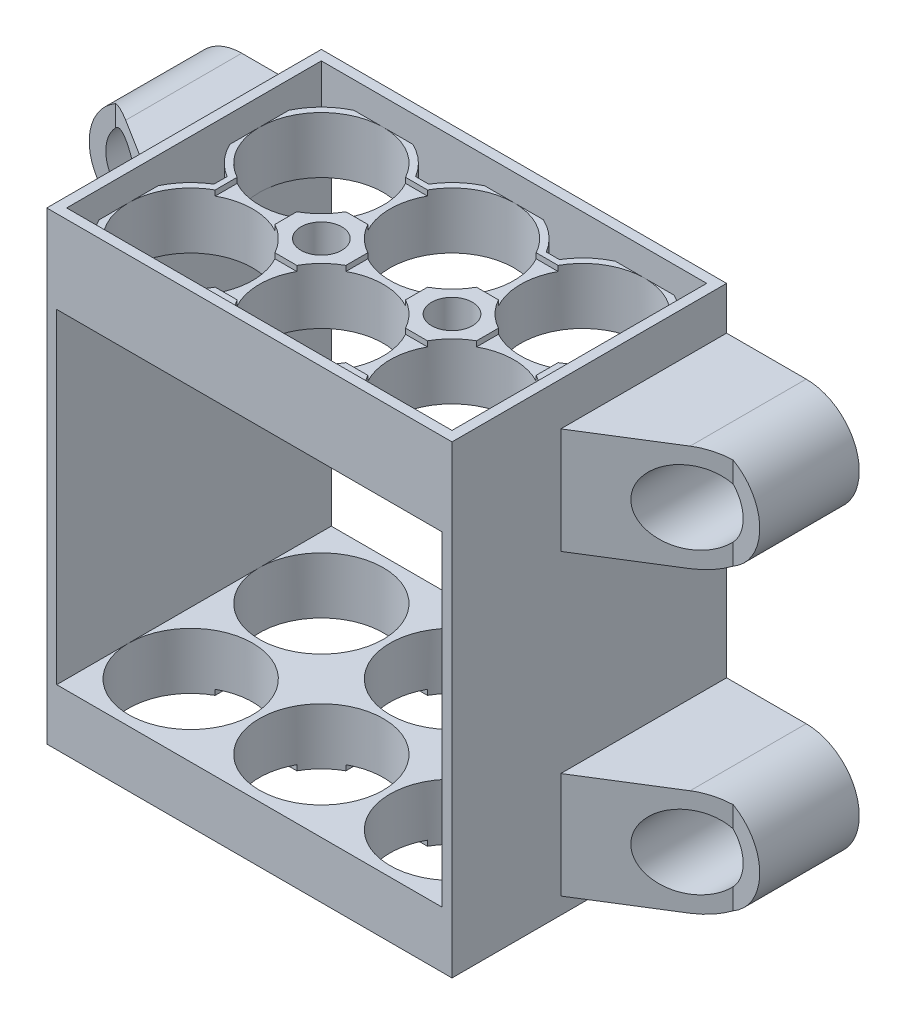
from build123d import *

# Parameters (mm, degrees)
SKETCH3_W                       = 61.1
SKETCH3_H                       = 41.4
SKETCH3_R                       = 9.35
BOSS_EXTRUDE1_DEPTH             = 66
SKETCH4_R                       = 3.080003589
CUT_EXTRUDE1_DEPTH              = 76.616086252
BOSS_EXTRUDE2_REACH             = 77.616
SKETCH5_W                       = 61.1
SKETCH5_H                       = 1
BOSS_EXTRUDE2_DIRECTION_2_REACH = 77.616
CUT_EXTRUDE3_DEPTH              = 76.616086252
CUT_EXTRUDE3_DEPTH_BACK         = 76.616086252
SKETCH5_3_W                     = 58.1
SKETCH5_3_H                     = 49
SKETCH7_R                       = 9.35
CUT_EXTRUDE4_DEPTH              = 76.616086252
BOSS_EXTRUDE3_START             = -20.7
SKETCH8_R                       = 8
SKETCH8_R_2                     = 5.5
BOSS_EXTRUDE3_DEPTH             = 41.4
CUT_EXTRUDE6_DEPTH              = 86.672588965
CUT_EXTRUDE6_DEPTH_BACK         = 86.672588965
SKETCH10_R                      = 8
SKETCH10_R_2                    = 2.25
BOSS_EXTRUDE4_DEPTH             = 5
SKETCH11_W                      = 61.1
SKETCH11_H                      = 41.4
SKETCH11_W_2                    = 58.1
SKETCH11_H_2                    = 38.4
BOSS_EXTRUDE5_DEPTH             = 4
CUT_EXTRUDE7_START              = -0.8
CUT_EXTRUDE7_DEPTH              = 0.8
CUT_EXTRUDE8_START              = -66
CUT_EXTRUDE8_DEPTH              = 0.8


with BuildPart() as part:
    # Sketch3 → Boss-Extrude1 (new body)
    with BuildSketch(Plane(origin=(0, 0, 0), x_dir=(1, 0, 0), z_dir=(0, 1, 0))):
        Rectangle(SKETCH3_W, SKETCH3_H)
        with Locations(Location((-19.7, 9.85, 0), (0, 0, 270))):
            Circle(SKETCH3_R, mode=Mode.SUBTRACT)
        with Locations(Location((0, 9.85, 0), (0, 0, 270))):
            Circle(SKETCH3_R, mode=Mode.SUBTRACT)
        with Locations(Location((19.7, 9.85, 0), (0, 0, 270))):
            Circle(SKETCH3_R, mode=Mode.SUBTRACT)
        with Locations(Location((-19.7, -9.85, 0), (0, 0, 270))):
            Circle(SKETCH3_R, mode=Mode.SUBTRACT)
        with Locations(Location((0, -9.85, 0), (0, 0, 270))):
            Circle(SKETCH3_R, mode=Mode.SUBTRACT)
        with Locations(Location((19.7, -9.85, 0), (0, 0, 270))):
            Circle(SKETCH3_R, mode=Mode.SUBTRACT)
    extrude(amount=BOSS_EXTRUDE1_DEPTH)

    # Sketch4 → Cut-Extrude1 (cut, through all)
    with BuildSketch(Plane(origin=(0, 0, 0), x_dir=(1, 0, 0), z_dir=(0, 1, 0))):
        with Locations(Location((-9.85, 0, 0), (0, 0, 270))):
            Circle(SKETCH4_R)
        with Locations(Location((9.85, 0, 0), (0, 0, 270))):
            Circle(SKETCH4_R)
        with BuildLine():
            Line((-4.438468204, 19.2), (-15.261531796, 19.2))
            ThreePointArc((-15.261531796, 19.2), (-12.756480414, 17.525287341), (-10.839977427, 15.2))
            Line((-10.839977427, 15.2), (-8.860022573, 15.2))
            ThreePointArc((-8.860022573, 15.2), (-6.943519586, 17.525287341), (-4.438468204, 19.2))
        make_face()
        with BuildLine():
            Line((15.261531796, 19.2), (4.438468204, 19.2))
            ThreePointArc((4.438468204, 19.2), (6.943519586, 17.525287341), (8.860022573, 15.2))
            Line((8.860022573, 15.2), (10.839977427, 15.2))
            ThreePointArc((10.839977427, 15.2), (12.756480414, 17.525287341), (15.261531796, 19.2))
        make_face()
        with BuildLine():
            Line((29.05, -5.411531796), (29.05, 5.411531796))
            ThreePointArc((29.05, 5.411531796), (27.375287341, 2.906480414), (25.05, 0.989977427))
            Line((25.05, 0.989977427), (25.05, -0.989977427))
            ThreePointArc((25.05, -0.989977427), (27.375287341, -2.906480414), (29.05, -5.411531796))
        make_face()
        with BuildLine():
            Line((29.05, -19.2), (29.05, -14.288468204))
            ThreePointArc((29.05, -14.288468204), (27.018555185, -17.168555185), (24.138468204, -19.2))
            Line((24.138468204, -19.2), (29.05, -19.2))
        make_face()
        with BuildLine():
            Line((29.05, 19.2), (24.138468204, 19.2))
            ThreePointArc((24.138468204, 19.2), (27.018555185, 17.168555185), (29.05, 14.288468204))
            Line((29.05, 14.288468204), (29.05, 19.2))
        make_face()
        with BuildLine():
            ThreePointArc((15.261531796, -19.2), (12.756480414, -17.525287341), (10.839977427, -15.2))
            Line((10.839977427, -15.2), (8.860022573, -15.2))
            ThreePointArc((8.860022573, -15.2), (6.943519586, -17.525287341), (4.438468204, -19.2))
            Line((4.438468204, -19.2), (15.261531796, -19.2))
        make_face()
        with BuildLine():
            ThreePointArc((-4.438468204, -19.2), (-6.943519586, -17.525287341), (-8.860022573, -15.2))
            Line((-8.860022573, -15.2), (-10.839977427, -15.2))
            ThreePointArc((-10.839977427, -15.2), (-12.756480414, -17.525287341), (-15.261531796, -19.2))
            Line((-15.261531796, -19.2), (-4.438468204, -19.2))
        make_face()
        with BuildLine():
            ThreePointArc((-24.138468204, -19.2), (-27.018555185, -17.168555185), (-29.05, -14.288468204))
            Line((-29.05, -14.288468204), (-29.05, -19.2))
            Line((-29.05, -19.2), (-24.138468204, -19.2))
        make_face()
        with BuildLine():
            ThreePointArc((-25.05, 0.989977427), (-27.375287341, 2.906480414), (-29.05, 5.411531796))
            Line((-29.05, 5.411531796), (-29.05, -5.411531796))
            ThreePointArc((-29.05, -5.411531796), (-27.375287341, -2.906480414), (-25.05, -0.989977427))
            Line((-25.05, -0.989977427), (-25.05, 0.989977427))
        make_face()
        with BuildLine():
            ThreePointArc((-29.05, 14.288468204), (-27.018555185, 17.168555185), (-24.138468204, 19.2))
            Line((-24.138468204, 19.2), (-29.05, 19.2))
            Line((-29.05, 19.2), (-29.05, 14.288468204))
        make_face()
    extrude(amount=CUT_EXTRUDE1_DEPTH, mode=Mode.SUBTRACT)

    # Boss-Extrude2: up to this face of the body (flat: up to its plane)
    boss_extrude2_end = Plane(part.part.faces().sort_by_distance((0, 33, 20.7))[0])
    # Sketch5 → Boss-Extrude2 (add, up to the picked face)
    with BuildSketch(Plane.XY, mode=Mode.PRIVATE) as boss_extrude2_sk1:
        with Locations((0, 58)):
            Rectangle(SKETCH5_W, SKETCH5_H)
    boss_extrude2_tool1 = split(extrude(boss_extrude2_sk1.sketch, amount=BOSS_EXTRUDE2_REACH, mode=Mode.PRIVATE), bisect_by=boss_extrude2_end, keep=Keep.BOTH, mode=Mode.PRIVATE)
    # Sketch5 → Boss-Extrude2 (add, up to the picked face)
    with BuildSketch(Plane.XY, mode=Mode.PRIVATE) as boss_extrude2_sk2:
        with Locations((0, 8)):
            Rectangle(SKETCH5_W, SKETCH5_H)
    boss_extrude2_tool2 = split(extrude(boss_extrude2_sk2.sketch, amount=BOSS_EXTRUDE2_REACH, mode=Mode.PRIVATE), bisect_by=boss_extrude2_end, keep=Keep.BOTH, mode=Mode.PRIVATE)
    add(boss_extrude2_tool1.solids().sort_by(Axis((0, 58, 0), (0, 0, 1)))[0])
    add(boss_extrude2_tool2.solids().sort_by(Axis((0, 8, 0), (0, 0, 1)))[0])

    # Boss-Extrude2 direction 2: up to this face of the body (flat: up to its plane)
    boss_extrude2_direction_2_end = Plane(part.part.faces().sort_by_distance((0, 33, -20.7))[0])
    # Sketch5 → Boss-Extrude2 direction 2 (add, up to the picked face)
    with BuildSketch(Plane.XY, mode=Mode.PRIVATE) as boss_extrude2_direction_2_sk1:
        with Locations((0, 58)):
            Rectangle(SKETCH5_W, SKETCH5_H)
    boss_extrude2_direction_2_tool1 = split(extrude(boss_extrude2_direction_2_sk1.sketch, amount=-BOSS_EXTRUDE2_DIRECTION_2_REACH, mode=Mode.PRIVATE), bisect_by=boss_extrude2_direction_2_end, keep=Keep.BOTH, mode=Mode.PRIVATE)
    # Sketch5 → Boss-Extrude2 direction 2 (add, up to the picked face)
    with BuildSketch(Plane.XY, mode=Mode.PRIVATE) as boss_extrude2_direction_2_sk2:
        with Locations((0, 8)):
            Rectangle(SKETCH5_W, SKETCH5_H)
    boss_extrude2_direction_2_tool2 = split(extrude(boss_extrude2_direction_2_sk2.sketch, amount=-BOSS_EXTRUDE2_DIRECTION_2_REACH, mode=Mode.PRIVATE), bisect_by=boss_extrude2_direction_2_end, keep=Keep.BOTH, mode=Mode.PRIVATE)
    add(boss_extrude2_direction_2_tool1.solids().sort_by(Axis((0, 58, 0), (0, 0, -1)))[0])
    add(boss_extrude2_direction_2_tool2.solids().sort_by(Axis((0, 8, 0), (0, 0, -1)))[0])

    # Sketch5<3> → Cut-Extrude3 (cut, two sides: drawn at the far end of the back side and taken through both)
    with BuildSketch(Plane.XY.offset(-CUT_EXTRUDE3_DEPTH_BACK)):
        with Locations((0, 33)):
            Rectangle(SKETCH5_3_W, SKETCH5_3_H)
    extrude(amount=CUT_EXTRUDE3_DEPTH + CUT_EXTRUDE3_DEPTH_BACK, mode=Mode.SUBTRACT)

    # Sketch7 → Cut-Extrude4 (cut, through all)
    with BuildSketch(Plane(origin=(0, 0, 0), x_dir=(1, 0, 0), z_dir=(0, 1, 0))):
        with Locations(Location((-19.7, 9.85, 0), (0, 0, 180))):
            Circle(SKETCH7_R)
        with Locations(Location((0, 9.85, 0), (0, 0, 270))):
            Circle(SKETCH7_R)
        with Locations((19.7, 9.85)):
            Circle(SKETCH7_R)
        with Locations((19.7, -9.85)):
            Circle(SKETCH7_R)
        with Locations(Location((0, -9.85, 0), (0, 0, 270))):
            Circle(SKETCH7_R)
        with Locations(Location((-19.7, -9.85, 0), (0, 0, 180))):
            Circle(SKETCH7_R)
    extrude(amount=CUT_EXTRUDE4_DEPTH, mode=Mode.SUBTRACT)

    # Sketch8 → Boss-Extrude3 (add)
    # profile 1 of 8: a face of its own
    with BuildSketch(Plane.XY.offset(BOSS_EXTRUDE3_START)):
        with BuildLine():
            Line((-30.55, 63.5), (-42.55, 63.5))
            ThreePointArc((-42.55, 63.5), (-36.893145751, 61.156854249), (-34.55, 55.5))
            ThreePointArc((-34.55, 55.5), (-36.893145751, 49.843145751), (-42.55, 47.5))
            Line((-42.55, 47.5), (-30.55, 47.5))
            Line((-30.55, 47.5), (-30.55, 63.5))
        make_face()
    # profile 2 of 8: a face of its own
    with BuildSketch(Plane.XY.offset(BOSS_EXTRUDE3_START)):
        with Locations((-42.55, 55.5)):
            Circle(SKETCH8_R)
        with Locations(Location((-42.55, 55.5, 0), (0, 0, 180))):
            Circle(SKETCH8_R_2, mode=Mode.SUBTRACT)
    # profile 3 of 8: a face of its own
    with BuildSketch(Plane.XY.offset(BOSS_EXTRUDE3_START)):
        with BuildLine():
            Line((30.55, 47.5), (42.55, 47.5))
            ThreePointArc((42.55, 47.5), (34.55, 55.5), (42.55, 63.5))
            Line((42.55, 63.5), (30.55, 63.5))
            Line((30.55, 63.5), (30.55, 47.5))
        make_face()
    # profile 4 of 8: a face of its own
    with BuildSketch(Plane.XY.offset(BOSS_EXTRUDE3_START)):
        with Locations((42.55, 55.5)):
            Circle(SKETCH8_R)
        with Locations(Location((42.55, 55.5, 0), (0, 0, 180))):
            Circle(SKETCH8_R_2, mode=Mode.SUBTRACT)
    # profile 5 of 8: a face of its own
    with BuildSketch(Plane.XY.offset(BOSS_EXTRUDE3_START)):
        with BuildLine():
            Line((30.55, 2.5), (42.55, 2.5))
            ThreePointArc((42.55, 2.5), (34.55, 10.5), (42.55, 18.5))
            Line((42.55, 18.5), (30.55, 18.5))
            Line((30.55, 18.5), (30.55, 2.5))
        make_face()
    # profile 6 of 8: a face of its own
    with BuildSketch(Plane.XY.offset(BOSS_EXTRUDE3_START)):
        with Locations((42.55, 10.5)):
            Circle(SKETCH8_R)
        with Locations(Location((42.55, 10.5, 0), (0, 0, 180))):
            Circle(SKETCH8_R_2, mode=Mode.SUBTRACT)
    # profile 7 of 8: a face of its own
    with BuildSketch(Plane.XY.offset(BOSS_EXTRUDE3_START)):
        with Locations((-42.55, 10.5)):
            Circle(SKETCH8_R)
        with Locations(Location((-42.55, 10.5, 0), (0, 0, 180))):
            Circle(SKETCH8_R_2, mode=Mode.SUBTRACT)
    # profile 8 of 8: a face of its own
    with BuildSketch(Plane.XY.offset(BOSS_EXTRUDE3_START)):
        with BuildLine():
            Line((-30.55, 18.5), (-42.55, 18.5))
            ThreePointArc((-42.55, 18.5), (-36.893145751, 16.156854249), (-34.55, 10.5))
            ThreePointArc((-34.55, 10.5), (-36.893145751, 4.843145751), (-42.55, 2.5))
            Line((-42.55, 2.5), (-30.55, 2.5))
            Line((-30.55, 2.5), (-30.55, 18.5))
        make_face()
    extrude(amount=BOSS_EXTRUDE3_DEPTH)

    # Sketch9 → Cut-Extrude6 (cut, two sides: drawn at the far end of the back side and taken through both)
    with BuildSketch(Plane(origin=(0, 0, 0), x_dir=(1, 0, 0), z_dir=(0, 1, 0)).offset(-CUT_EXTRUDE6_DEPTH_BACK)):
        Polygon((-50.55, -20.7), (-30.55, -20.7), (-30.55, -4.3), (-46.55, 5.7), (-50.55, 5.7), align=None)
        Polygon((30.55, -20.7), (30.55, -4.3), (46.55, 5.7), (50.55, 5.7), (50.55, -20.7), align=None)
    extrude(amount=CUT_EXTRUDE6_DEPTH + CUT_EXTRUDE6_DEPTH_BACK, mode=Mode.SUBTRACT)

    # Sketch10 → Boss-Extrude4 (add)
    # profile 1 of 4: a face of its own
    with BuildSketch(Plane(origin=(0, 0, -20.7), x_dir=(-1, 0, 0), z_dir=(0, 0, -1))):
        with Locations((42.55, 10.5)):
            Circle(SKETCH10_R)
        with Locations((42.55, 10.5)):
            Circle(SKETCH10_R_2, mode=Mode.SUBTRACT)
    # profile 2 of 4: a face of its own
    with BuildSketch(Plane(origin=(0, 0, -20.7), x_dir=(-1, 0, 0), z_dir=(0, 0, -1))):
        with Locations((42.55, 55.5)):
            Circle(SKETCH10_R)
        with Locations((42.55, 55.5)):
            Circle(SKETCH10_R_2, mode=Mode.SUBTRACT)
    # profile 3 of 4: a face of its own
    with BuildSketch(Plane(origin=(0, 0, -20.7), x_dir=(-1, 0, 0), z_dir=(0, 0, -1))):
        with Locations((-42.55, 55.5)):
            Circle(SKETCH10_R)
        with Locations((-42.55, 55.5)):
            Circle(SKETCH10_R_2, mode=Mode.SUBTRACT)
    # profile 4 of 4: a face of its own
    with BuildSketch(Plane(origin=(0, 0, -20.7), x_dir=(-1, 0, 0), z_dir=(0, 0, -1))):
        with Locations((-42.55, 10.5)):
            Circle(SKETCH10_R)
        with Locations((-42.55, 10.5)):
            Circle(SKETCH10_R_2, mode=Mode.SUBTRACT)
    extrude(amount=-BOSS_EXTRUDE4_DEPTH)

    # Sketch11 → Boss-Extrude5 (add)
    with BuildSketch(Plane(origin=(0, 66, 0), x_dir=(1, 0, 0), z_dir=(0, 1, 0))):
        Rectangle(SKETCH11_W, SKETCH11_H)
        Rectangle(SKETCH11_W_2, SKETCH11_H_2, mode=Mode.SUBTRACT)
    extrude(amount=BOSS_EXTRUDE5_DEPTH)

    # Sketch12 → Cut-Extrude7 (cut)
    with BuildSketch(Plane(origin=(0, 66, 0), x_dir=(1, 0, 0), z_dir=(0, 1, 0)).offset(CUT_EXTRUDE7_START)):
        with BuildLine():
            Line((-24.2, 14.35), (-24.2, 1.654116887))
            ThreePointArc((-24.2, 1.654116887), (-19.7, 0.5), (-15.2, 1.654116887))
            Line((-15.2, 1.654116887), (-15.2, 5.35))
            Line((-15.2, 5.35), (-11.504116887, 5.35))
            ThreePointArc((-11.504116887, 5.35), (-10.35, 9.85), (-11.504116887, 14.35))
            Line((-11.504116887, 14.35), (-24.2, 14.35))
        make_face()
        with BuildLine():
            Line((-24.2, -1.654116887), (-24.2, -14.35))
            Line((-24.2, -14.35), (-11.504116887, -14.35))
            ThreePointArc((-11.504116887, -14.35), (-10.35, -9.85), (-11.504116887, -5.35))
            Line((-11.504116887, -5.35), (-15.2, -5.35))
            Line((-15.2, -5.35), (-15.2, -1.654116887))
            ThreePointArc((-15.2, -1.654116887), (-19.7, -0.5), (-24.2, -1.654116887))
        make_face()
        with BuildLine():
            ThreePointArc((-11.504116887, -5.35), (-10.35, -9.85), (-11.504116887, -14.35))
            Line((-11.504116887, -14.35), (-8.195883113, -14.35))
            ThreePointArc((-8.195883113, -14.35), (-9.35, -9.85), (-8.195883113, -5.35))
            Line((-8.195883113, -5.35), (-11.504116887, -5.35))
        make_face()
        with BuildLine():
            ThreePointArc((-8.195883113, -5.35), (-9.35, -9.85), (-8.195883113, -14.35))
            Line((-8.195883113, -14.35), (8.195883113, -14.35))
            ThreePointArc((8.195883113, -14.35), (9.056876037, -12.172820795), (9.35, -9.85))
            ThreePointArc((9.35, -9.85), (9.056876037, -7.527179205), (8.195883113, -5.35))
            Line((8.195883113, -5.35), (4.5, -5.35))
            Line((4.5, -5.35), (4.5, -1.654116887))
            ThreePointArc((4.5, -1.654116887), (0, -0.5), (-4.5, -1.654116887))
            Line((-4.5, -1.654116887), (-4.5, -5.35))
            Line((-4.5, -5.35), (-8.195883113, -5.35))
        make_face()
        with BuildLine():
            Line((-4.5, 5.35), (-4.5, 1.654116887))
            ThreePointArc((-4.5, 1.654116887), (0, 0.5), (4.5, 1.654116887))
            Line((4.5, 1.654116887), (4.5, 5.35))
            Line((4.5, 5.35), (8.195883113, 5.35))
            ThreePointArc((8.195883113, 5.35), (9.056876037, 7.527179205), (9.35, 9.85))
            ThreePointArc((9.35, 9.85), (9.056876037, 12.172820795), (8.195883113, 14.35))
            Line((8.195883113, 14.35), (-8.195883113, 14.35))
            ThreePointArc((-8.195883113, 14.35), (-9.35, 9.85), (-8.195883113, 5.35))
            Line((-8.195883113, 5.35), (-4.5, 5.35))
        make_face()
        with BuildLine():
            Line((-8.195883113, 14.35), (-11.504116887, 14.35))
            ThreePointArc((-11.504116887, 14.35), (-10.35, 9.85), (-11.504116887, 5.35))
            Line((-11.504116887, 5.35), (-8.195883113, 5.35))
            ThreePointArc((-8.195883113, 5.35), (-9.35, 9.85), (-8.195883113, 14.35))
        make_face()
        with BuildLine():
            Line((-4.5, 1.654116887), (-4.5, -1.654116887))
            ThreePointArc((-4.5, -1.654116887), (0, -0.5), (4.5, -1.654116887))
            Line((4.5, -1.654116887), (4.5, 1.654116887))
            ThreePointArc((4.5, 1.654116887), (0, 0.5), (-4.5, 1.654116887))
        make_face()
        with BuildLine():
            ThreePointArc((11.504116887, -5.35), (10.35, -9.85), (11.504116887, -14.35))
            Line((11.504116887, -14.35), (24.2, -14.35))
            Line((24.2, -14.35), (24.2, -1.654116887))
            ThreePointArc((24.2, -1.654116887), (19.7, -0.5), (15.2, -1.654116887))
            Line((15.2, -1.654116887), (15.2, -5.35))
            Line((15.2, -5.35), (11.504116887, -5.35))
        make_face()
        with BuildLine():
            Line((24.2, 14.35), (11.504116887, 14.35))
            ThreePointArc((11.504116887, 14.35), (10.35, 9.85), (11.504116887, 5.35))
            Line((11.504116887, 5.35), (15.2, 5.35))
            Line((15.2, 5.35), (15.2, 1.654116887))
            ThreePointArc((15.2, 1.654116887), (19.7, 0.5), (24.2, 1.654116887))
            Line((24.2, 1.654116887), (24.2, 14.35))
        make_face()
        with BuildLine():
            Line((15.2, 0), (24.2, 0))
            Line((24.2, 0), (24.2, 1.654116887))
            ThreePointArc((24.2, 1.654116887), (19.7, 0.5), (15.2, 1.654116887))
            Line((15.2, 1.654116887), (15.2, 0))
        make_face()
        with BuildLine():
            ThreePointArc((15.2, -1.654116887), (19.7, -0.5), (24.2, -1.654116887))
            Line((24.2, -1.654116887), (24.2, 0))
            Line((24.2, 0), (15.2, 0))
            Line((15.2, 0), (15.2, -1.654116887))
        make_face()
        with BuildLine():
            ThreePointArc((9.35, -9.85), (9.056876037, -12.172820795), (8.195883113, -14.35))
            Line((8.195883113, -14.35), (11.504116887, -14.35))
            ThreePointArc((11.504116887, -14.35), (10.35, -9.85), (11.504116887, -5.35))
            Line((11.504116887, -5.35), (8.195883113, -5.35))
            ThreePointArc((8.195883113, -5.35), (9.056876037, -7.527179205), (9.35, -9.85))
        make_face()
        with BuildLine():
            Line((11.504116887, 14.35), (8.195883113, 14.35))
            ThreePointArc((8.195883113, 14.35), (9.056876037, 12.172820795), (9.35, 9.85))
            ThreePointArc((9.35, 9.85), (9.056876037, 7.527179205), (8.195883113, 5.35))
            Line((8.195883113, 5.35), (11.504116887, 5.35))
            ThreePointArc((11.504116887, 5.35), (10.35, 9.85), (11.504116887, 14.35))
        make_face()
        with BuildLine():
            Line((-24.2, 1.654116887), (-24.2, -1.654116887))
            ThreePointArc((-24.2, -1.654116887), (-19.7, -0.5), (-15.2, -1.654116887))
            Line((-15.2, -1.654116887), (-15.2, 1.654116887))
            ThreePointArc((-15.2, 1.654116887), (-19.7, 0.5), (-24.2, 1.654116887))
        make_face()
    extrude(amount=CUT_EXTRUDE7_DEPTH, mode=Mode.SUBTRACT)

    # Sketch12<3> → Cut-Extrude8 (cut)
    with BuildSketch(Plane(origin=(0, 66, 0), x_dir=(1, 0, 0), z_dir=(0, 1, 0)).offset(CUT_EXTRUDE8_START)):
        with BuildLine():
            Line((-24.2, 14.35), (-24.2, 1.654116887))
            ThreePointArc((-24.2, 1.654116887), (-19.7, 0.5), (-15.2, 1.654116887))
            Line((-15.2, 1.654116887), (-15.2, 5.35))
            Line((-15.2, 5.35), (-11.504116887, 5.35))
            ThreePointArc((-11.504116887, 5.35), (-10.35, 9.85), (-11.504116887, 14.35))
            Line((-11.504116887, 14.35), (-24.2, 14.35))
        make_face()
        with BuildLine():
            Line((-24.2, -1.654116887), (-24.2, -14.35))
            Line((-24.2, -14.35), (-11.504116887, -14.35))
            ThreePointArc((-11.504116887, -14.35), (-10.35, -9.85), (-11.504116887, -5.35))
            Line((-11.504116887, -5.35), (-15.2, -5.35))
            Line((-15.2, -5.35), (-15.2, -1.654116887))
            ThreePointArc((-15.2, -1.654116887), (-19.7, -0.5), (-24.2, -1.654116887))
        make_face()
        with BuildLine():
            Line((-24.2, 1.654116887), (-24.2, -1.654116887))
            ThreePointArc((-24.2, -1.654116887), (-19.7, -0.5), (-15.2, -1.654116887))
            Line((-15.2, -1.654116887), (-15.2, 1.654116887))
            ThreePointArc((-15.2, 1.654116887), (-19.7, 0.5), (-24.2, 1.654116887))
        make_face()
        with BuildLine():
            ThreePointArc((-11.504116887, -5.35), (-10.35, -9.85), (-11.504116887, -14.35))
            Line((-11.504116887, -14.35), (-8.195883113, -14.35))
            ThreePointArc((-8.195883113, -14.35), (-9.35, -9.85), (-8.195883113, -5.35))
            Line((-8.195883113, -5.35), (-11.504116887, -5.35))
        make_face()
        with BuildLine():
            Line((-8.195883113, 14.35), (-11.504116887, 14.35))
            ThreePointArc((-11.504116887, 14.35), (-10.35, 9.85), (-11.504116887, 5.35))
            Line((-11.504116887, 5.35), (-8.195883113, 5.35))
            ThreePointArc((-8.195883113, 5.35), (-9.35, 9.85), (-8.195883113, 14.35))
        make_face()
        with BuildLine():
            Line((-4.5, 5.35), (-4.5, 1.654116887))
            ThreePointArc((-4.5, 1.654116887), (0, 0.5), (4.5, 1.654116887))
            Line((4.5, 1.654116887), (4.5, 5.35))
            Line((4.5, 5.35), (8.195883113, 5.35))
            ThreePointArc((8.195883113, 5.35), (9.056876037, 7.527179205), (9.35, 9.85))
            ThreePointArc((9.35, 9.85), (9.056876037, 12.172820795), (8.195883113, 14.35))
            Line((8.195883113, 14.35), (-8.195883113, 14.35))
            ThreePointArc((-8.195883113, 14.35), (-9.35, 9.85), (-8.195883113, 5.35))
            Line((-8.195883113, 5.35), (-4.5, 5.35))
        make_face()
        with BuildLine():
            ThreePointArc((-8.195883113, -5.35), (-9.35, -9.85), (-8.195883113, -14.35))
            Line((-8.195883113, -14.35), (8.195883113, -14.35))
            ThreePointArc((8.195883113, -14.35), (9.056876037, -12.172820795), (9.35, -9.85))
            ThreePointArc((9.35, -9.85), (9.056876037, -7.527179205), (8.195883113, -5.35))
            Line((8.195883113, -5.35), (4.5, -5.35))
            Line((4.5, -5.35), (4.5, -1.654116887))
            ThreePointArc((4.5, -1.654116887), (0, -0.5), (-4.5, -1.654116887))
            Line((-4.5, -1.654116887), (-4.5, -5.35))
            Line((-4.5, -5.35), (-8.195883113, -5.35))
        make_face()
        with BuildLine():
            Line((-4.5, 1.654116887), (-4.5, -1.654116887))
            ThreePointArc((-4.5, -1.654116887), (0, -0.5), (4.5, -1.654116887))
            Line((4.5, -1.654116887), (4.5, 1.654116887))
            ThreePointArc((4.5, 1.654116887), (0, 0.5), (-4.5, 1.654116887))
        make_face()
        with BuildLine():
            ThreePointArc((11.504116887, -5.35), (10.35, -9.85), (11.504116887, -14.35))
            Line((11.504116887, -14.35), (24.2, -14.35))
            Line((24.2, -14.35), (24.2, -1.654116887))
            ThreePointArc((24.2, -1.654116887), (19.7, -0.5), (15.2, -1.654116887))
            Line((15.2, -1.654116887), (15.2, -5.35))
            Line((15.2, -5.35), (11.504116887, -5.35))
        make_face()
        with BuildLine():
            Line((24.2, 14.35), (11.504116887, 14.35))
            ThreePointArc((11.504116887, 14.35), (10.35, 9.85), (11.504116887, 5.35))
            Line((11.504116887, 5.35), (15.2, 5.35))
            Line((15.2, 5.35), (15.2, 1.654116887))
            ThreePointArc((15.2, 1.654116887), (19.7, 0.5), (24.2, 1.654116887))
            Line((24.2, 1.654116887), (24.2, 14.35))
        make_face()
        with BuildLine():
            Line((11.504116887, 14.35), (8.195883113, 14.35))
            ThreePointArc((8.195883113, 14.35), (9.056876037, 12.172820795), (9.35, 9.85))
            ThreePointArc((9.35, 9.85), (9.056876037, 7.527179205), (8.195883113, 5.35))
            Line((8.195883113, 5.35), (11.504116887, 5.35))
            ThreePointArc((11.504116887, 5.35), (10.35, 9.85), (11.504116887, 14.35))
        make_face()
        with BuildLine():
            ThreePointArc((9.35, -9.85), (9.056876037, -12.172820795), (8.195883113, -14.35))
            Line((8.195883113, -14.35), (11.504116887, -14.35))
            ThreePointArc((11.504116887, -14.35), (10.35, -9.85), (11.504116887, -5.35))
            Line((11.504116887, -5.35), (8.195883113, -5.35))
            ThreePointArc((8.195883113, -5.35), (9.056876037, -7.527179205), (9.35, -9.85))
        make_face()
        with BuildLine():
            ThreePointArc((15.2, -1.654116887), (19.7, -0.5), (24.2, -1.654116887))
            Line((24.2, -1.654116887), (24.2, 0))
            Line((24.2, 0), (15.2, 0))
            Line((15.2, 0), (15.2, -1.654116887))
        make_face()
        with BuildLine():
            Line((15.2, 0), (24.2, 0))
            Line((24.2, 0), (24.2, 1.654116887))
            ThreePointArc((24.2, 1.654116887), (19.7, 0.5), (15.2, 1.654116887))
            Line((15.2, 1.654116887), (15.2, 0))
        make_face()
    extrude(amount=CUT_EXTRUDE8_DEPTH, mode=Mode.SUBTRACT)


solid = part.part
